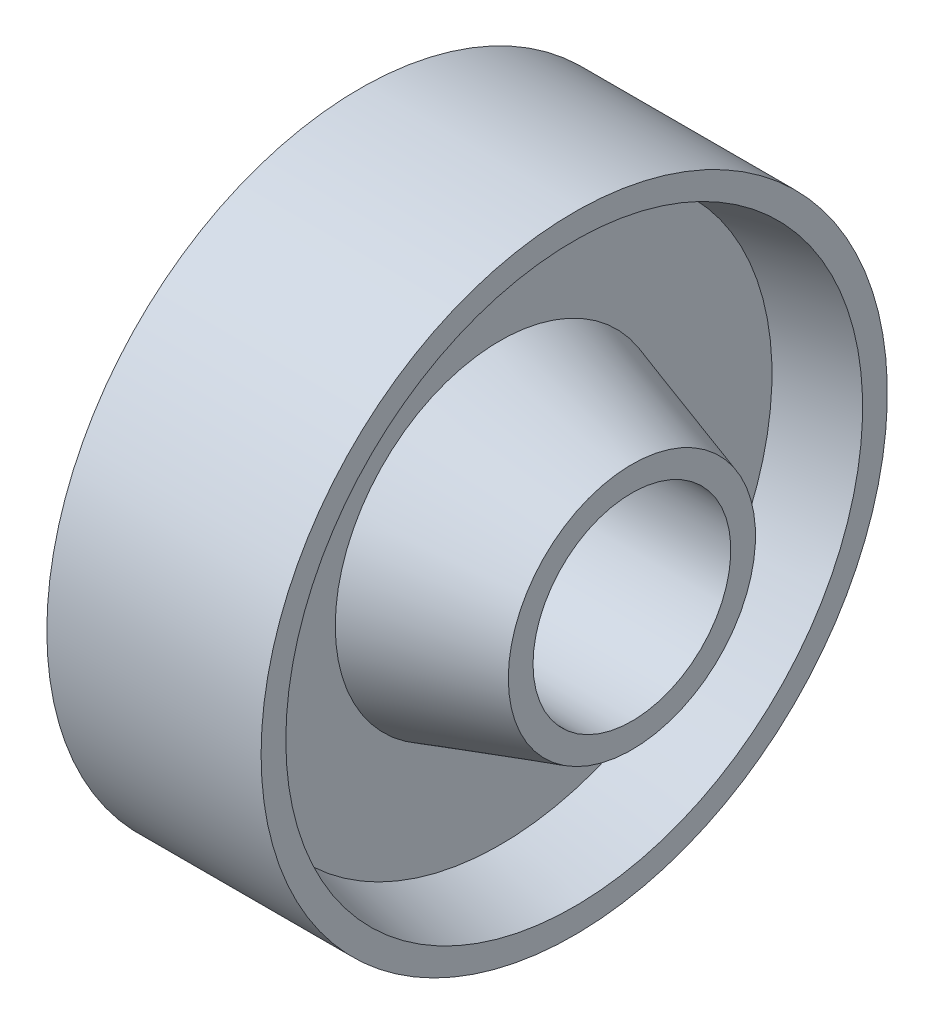
from build123d import *


with BuildPart() as part:
    # Sketch1 → Revolve1 (revolve)
    with BuildSketch(Plane.XY, mode=Mode.PRIVATE) as revolve1_sk:
        Polygon((4, 20), (4, 33), (13, 35), (13, 38), (-13, 38), (-13, 35), (-4, 33), (-4, 20), (-20, 15), (-20, 12), (20, 12), (20, 15), align=None)
    revolve(revolve1_sk.sketch.rotate(Axis((-25.431558422, 0, 0), (1, 0, 0)), 90), axis=Axis((-25.431558422, 0, 0), (1, 0, 0)))


solid = part.part
